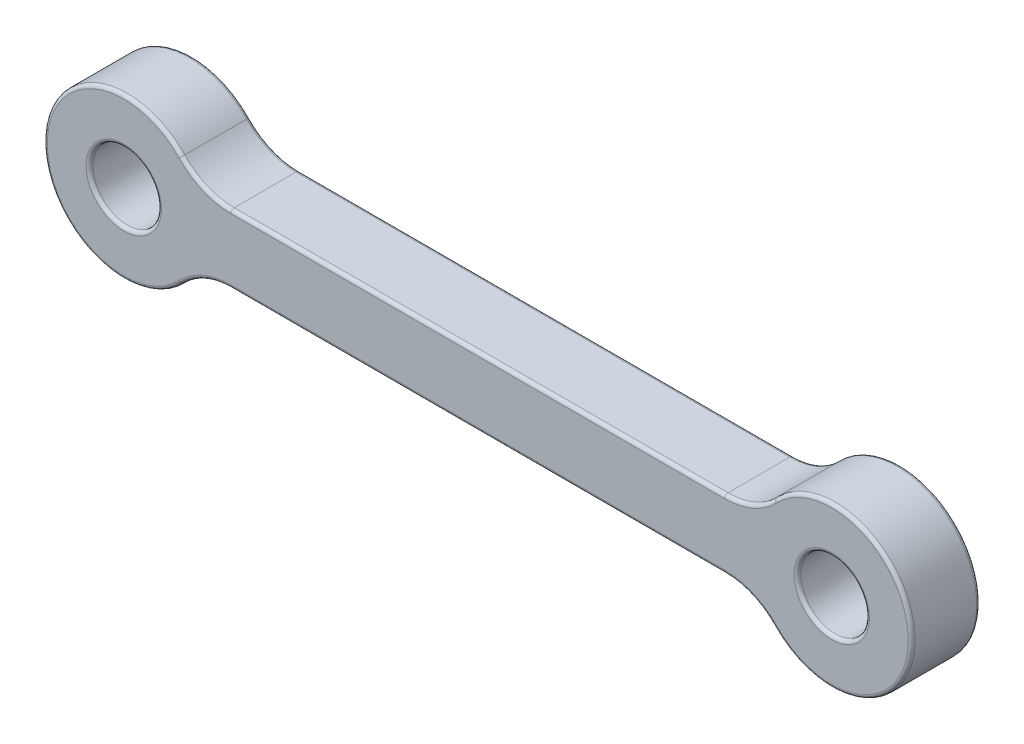
from build123d import *

# Parameters (mm, degrees)
SKETCH1_R           = 3.5
SKETCH1_R_2         = 1.5
BOSS_EXTRUDE1_DEPTH = 1.5
FILLET1_R           = 3
FILLET2_R           = 0.15


with BuildPart() as part:
    # Sketch1 → Boss-Extrude1 (new, symmetric)
    # profile 1 of 3: a face of its own
    with BuildSketch(Plane.XY):
        Circle(SKETCH1_R)
        Circle(SKETCH1_R_2, mode=Mode.SUBTRACT)
    # profile 2 of 3: a face of its own
    with BuildSketch(Plane.XY):
        with BuildLine():
            Line((3.16227766, -1.5), (27.83772234, -1.5))
            ThreePointArc((27.83772234, -1.5), (27.5, 0), (27.83772234, 1.5))
            Line((27.83772234, 1.5), (3.16227766, 1.5))
            ThreePointArc((3.16227766, 1.5), (3.414525722, 0.768774411), (3.5, 0))
            ThreePointArc((3.5, 0), (3.414525722, -0.768774411), (3.16227766, -1.5))
        make_face()
    # profile 3 of 3: a face of its own
    with BuildSketch(Plane.XY):
        with Locations((31, 0)):
            Circle(SKETCH1_R)
        with Locations((31, 0)):
            Circle(SKETCH1_R_2, mode=Mode.SUBTRACT)
    extrude(amount=BOSS_EXTRUDE1_DEPTH, both=True)

    # Fillet1
    fillet1_edges = [part.edges().sort_by_distance(p)[0] for p in [
        (3.16227766, 1.5, 0),
        (27.83772234, 1.5, 0),
        (27.83772234, -1.5, 0),
        (3.16227766, -1.5, 0),
    ]]
    fillet(fillet1_edges, radius=FILLET1_R)

    # Fillet2
    fillet2_edges = [part.edges().sort_by_distance(p)[0] for p in [
        (-1.5, 0, -1.5),
        (-3.5, 0, -1.5),
        (-3.5, 0, 1.5),
        (15.5, 1.5, -1.5),
        (15.5, 1.5, 1.5),
        (34.5, 0, -1.5),
        (34.5, 0, 1.5),
        (15.5, -1.5, -1.5),
        (15.5, -1.5, 1.5),
        (3.513718949, 1.740401367, -1.5),
        (3.513718949, 1.740401367, 1.5),
        (27.486281051, 1.740401367, -1.5),
        (29.5, 0, 1.5),
        (27.486281051, 1.740401367, 1.5),
        (3.513718949, -1.740401367, -1.5),
        (3.513718949, -1.740401367, 1.5),
        (27.486281051, -1.740401367, -1.5),
        (27.486281051, -1.740401367, 1.5),
        (-1.5, 0, 1.5),
        (29.5, 0, -1.5),
    ]]
    fillet(fillet2_edges, radius=FILLET2_R)


solid = part.part
